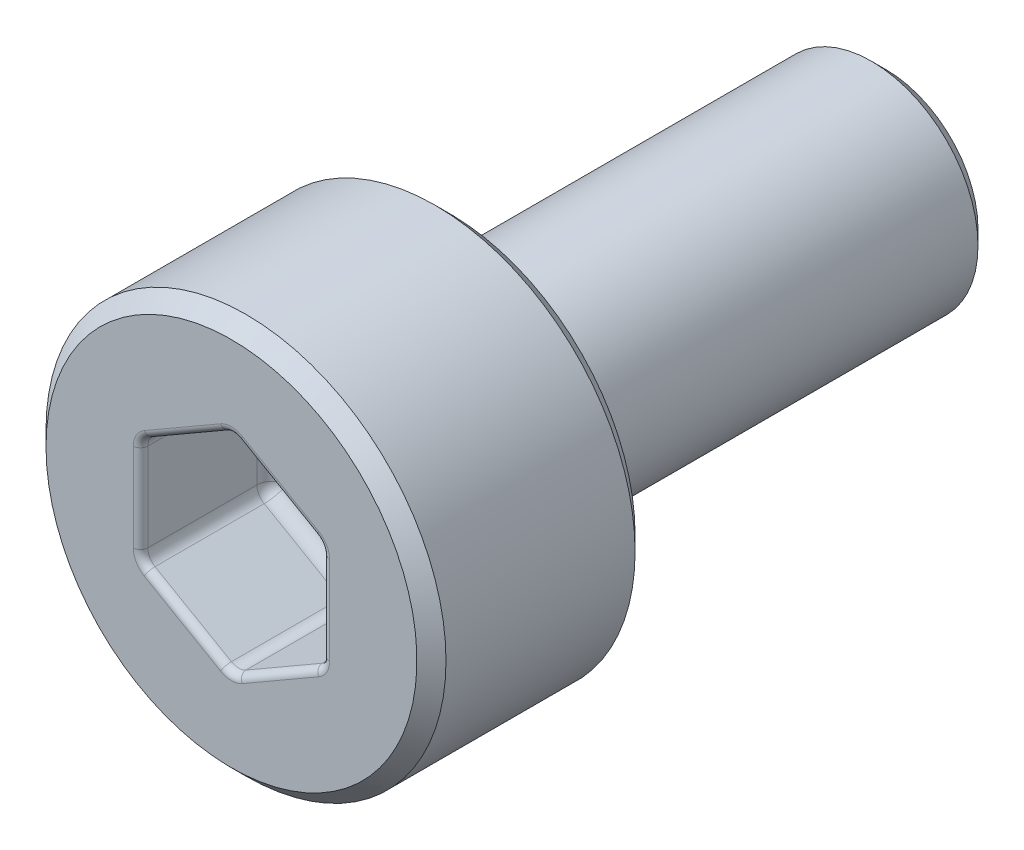
from build123d import *

# Parameters (mm, degrees)
SCHNITT_LINEAR_AUSTRAGEN1_DEPTH = 1.8
FASE1_SIZE                      = 0.2
VERRUNDUNG1_R                   = 0.2
VERRUNDUNG2_R                   = 0.1


with BuildPart() as part:
    # Skizze1 → Rotation1 (revolve)
    with BuildSketch(Plane(origin=(0, 0, 0), x_dir=(0, 0, -1), z_dir=(1, 0, 0))):
        Polygon((-3, 0), (-3, 2.75), (0, 2.75), (0, 1.465), (6, 1.465), (6, 0), align=None)
    revolve(axis=Axis((0, 0, 21.919879518), (0, 0, -1)))

    # Skizze2 → Schnitt-Linear austragen1 (cut)
    with BuildSketch(Plane.XY.offset(3)):
        Polygon((1.25, -0.721687836), (1.25, 0.721687836), (0, 1.443375673), (-1.25, 0.721687836), (-1.25, -0.721687836), (0, -1.443375673), align=None)
    extrude(amount=-SCHNITT_LINEAR_AUSTRAGEN1_DEPTH, mode=Mode.SUBTRACT)

    # Fase1
    fase1_edges = [part.edges().sort_by_distance(p)[0] for p in [
        (0, -2.75, 3),
        (0, -2.75, 0),
        (0, -1.465, -6),
    ]]
    chamfer(fase1_edges, length=FASE1_SIZE)

    # Verrundung1
    verrundung1_edges = [part.edges().sort_by_distance(p)[0] for p in [
        (-0.625, -1.082531755, 1.2),
        (-1.25, 0, 1.2),
        (-0.625, 1.082531755, 1.2),
        (0.625, 1.082531755, 1.2),
        (1.25, 0, 1.2),
        (0.625, -1.082531755, 1.2),
        (-1.25, -0.721687836, 2.1),
        (0, -1.443375673, 2.1),
        (1.25, -0.721687836, 2.1),
        (1.25, 0.721687836, 2.1),
        (0, 1.443375673, 2.1),
        (-1.25, 0.721687836, 2.1),
        (0, -1.465, 0),
    ]]
    fillet(verrundung1_edges, radius=VERRUNDUNG1_R)

    # Verrundung2
    verrundung2_edges = [part.edges().sort_by_distance(p)[0] for p in [
        (1.223205081, -0.706217783, 3),
        (0.625, -1.082531755, 3),
        (0, -1.412435565, 3),
        (-0.625, -1.082531755, 3),
        (-1.223205081, -0.706217783, 3),
        (-1.25, 0, 3),
        (-1.223205081, 0.706217783, 3),
        (-0.625, 1.082531755, 3),
        (0, 1.412435565, 3),
        (0.625, 1.082531755, 3),
        (1.223205081, 0.706217783, 3),
        (1.25, 0, 3),
    ]]
    fillet(verrundung2_edges, radius=VERRUNDUNG2_R)


solid = part.part
